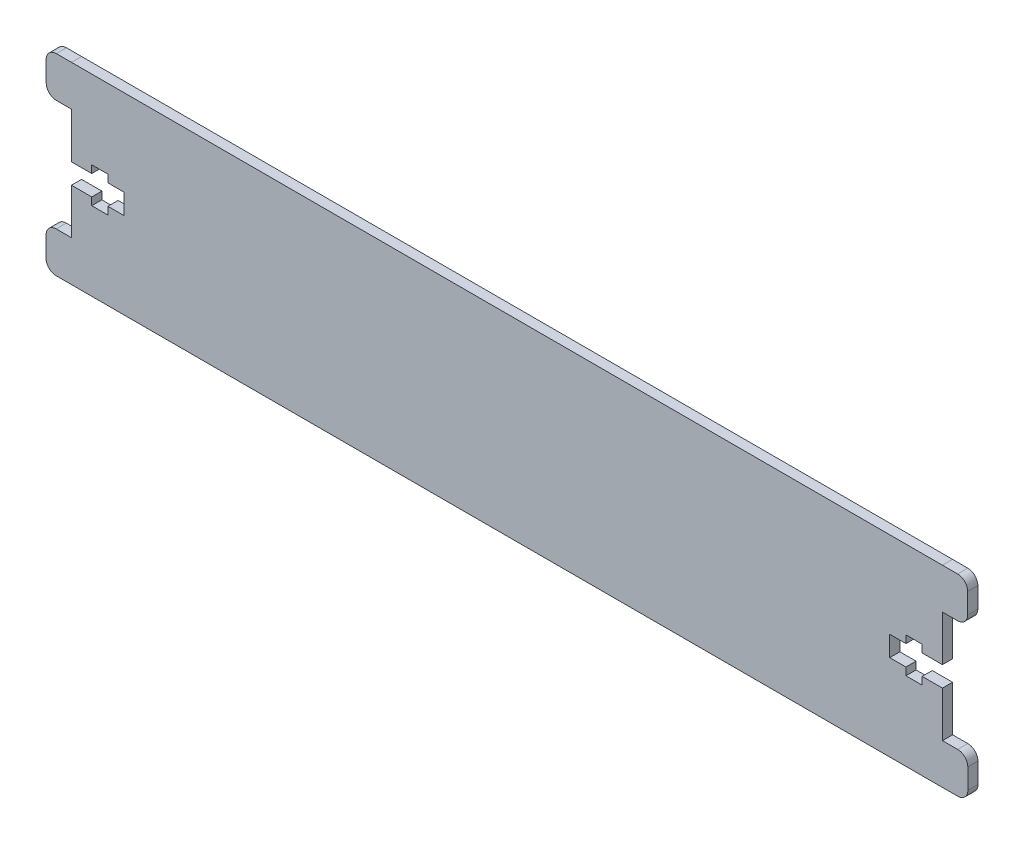
from build123d import *

# Parameters (mm, degrees)
EXTRUDE_1_DEPTH = 2
FILLET_1_R      = 2


with BuildPart() as part:
    # 草图1 → 凸台-拉伸1 (new body)
    with BuildSketch(Plane.XY):
        Polygon((81.543574606, -5.900283983), (76.543576359, -5.904470333), (76.543576359, 3.08), (72.531874134, 3.08), (72.531874134, 1.58), (69.331874134, 1.58), (69.331874134, 3.08), (66.131874134, 3.08), (66.131874134, 7.08), (69.331874134, 7.08), (69.331874134, 8.58), (72.531874134, 8.58), (72.531874134, 7.08), (76.531874134, 7.08), (76.520862712, 16.085955117), (81.520858939, 16.092097641), (81.533074683, 24.092088314), (76.533079924, 24.099327787), (-95.466920076, 24.099327787), (-100.466914835, 24.092088314), (-100.454699091, 16.092097641), (-95.454702864, 16.085955117), (-95.465714286, 7.08), (-91.465714286, 7.08), (-91.465714286, 8.58), (-88.265714286, 8.58), (-88.265714286, 7.08), (-85.065714286, 7.08), (-85.065714286, 3.08), (-88.265714286, 3.08), (-88.265714286, 1.58), (-91.465714286, 1.58), (-91.465714286, 3.08), (-95.47741651, 3.08), (-95.47741651, -5.904470333), (-100.477414758, -5.900283983), (-100.506156647, -13.900232352), (-95.506187511, -13.917800667), (76.57234736, -13.917800667), (81.572316495, -13.900232352), align=None)
    extrude(amount=EXTRUDE_1_DEPTH)

    # 圆角1
    fillet_1_edges = [part.edges().sort_by_distance(p)[0] for p in [
        (-100.506156647, -13.900232352, 1),
        (-100.477414758, -5.900283983, 1),
        (-100.454699091, 16.092097641, 1),
        (-100.466914835, 24.092088314, 1),
        (81.533074683, 24.092088314, 1),
        (81.520858939, 16.092097641, 1),
        (81.543574606, -5.900283983, 1),
        (81.572316495, -13.900232352, 1),
    ]]
    fillet(fillet_1_edges, radius=FILLET_1_R)


solid = part.part
